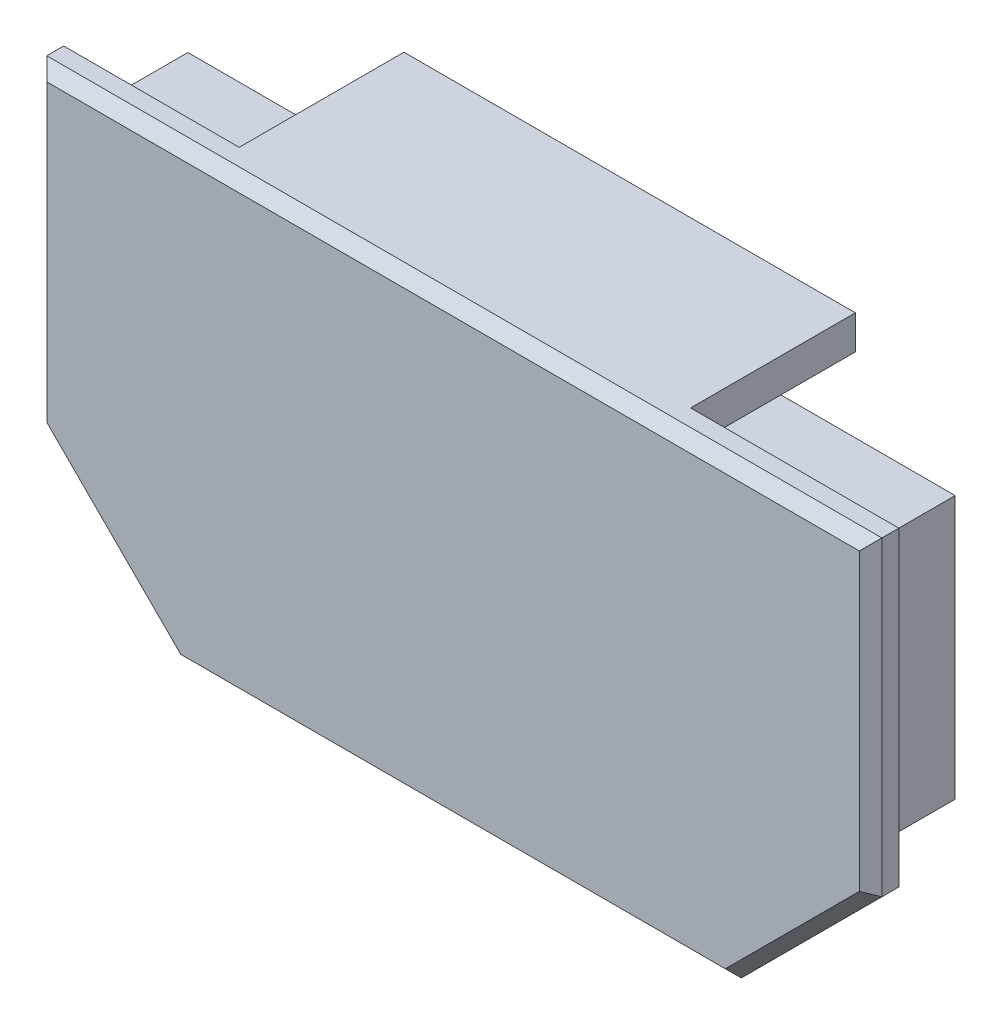
from build123d import *

# Parameters (mm, degrees)
PRESS_FIT_WALL_EXTRUDE_DEPTH = 8
MAIN_LID_EXTRUDE_DEPTH       = 2.5
MAIN_LID_CHAMFER_SIZE        = 1
MAIN_LID_TAB_CUT_DEPTH       = 3
SKETCH5_W                    = 40
SKETCH5_H                    = 3
SERVO_WALL_EXTRUDE_DEPTH     = 14.6


with BuildPart() as part:
    # Sketch2 → Press Fit Wall Extrude (new body)
    with BuildSketch(Plane.XY):
        Polygon((34, -6.3), (34, 17), (-34, 17), (-34, -6.3), (-23.3, -17), (23.3, -17), align=None)
        Polygon((32, -5.471572875), (32, 15), (-32, 15), (-32, -5.471572875), (-22.471572875, -15), (22.471572875, -15), align=None, mode=Mode.SUBTRACT)
    extrude(amount=-PRESS_FIT_WALL_EXTRUDE_DEPTH)

    # Sketch3 → Main Lid Extrude (add)
    with BuildSketch(Plane.XY):
        Polygon((24.542640687, -20), (37, -7.542640687), (37, 20), (-37, 20), (-37, -7.542640687), (-24.542640687, -20), align=None)
    extrude(amount=MAIN_LID_EXTRUDE_DEPTH)

    # Main Lid Chamfer
    main_lid_chamfer_edges = [part.edges().sort_by_distance(p)[0] for p in [
        (0, -20, 2.5),
        (30.771320344, -13.771320344, 2.5),
        (37, 6.228679656, 2.5),
        (0, 20, 2.5),
        (-37, 6.228679656, 2.5),
        (-30.771320344, -13.771320344, 2.5),
    ]]
    chamfer(main_lid_chamfer_edges, length=MAIN_LID_CHAMFER_SIZE)

    # Sketch4 → Main Lid Tab Cut (cut)
    with BuildSketch(Plane.XZ.offset(20)):
        Polygon((-4, 0), (4, 0), (2.267949192, 1), (-2.267949192, 1), align=None)
    extrude(amount=-MAIN_LID_TAB_CUT_DEPTH, mode=Mode.SUBTRACT)

    # Sketch5 → Servo Wall Extrude (add)
    with BuildSketch(Plane(origin=(0, 0, 0), x_dir=(-1, 0, 0), z_dir=(0, 0, -1))):
        with Locations((1.45, 18.5)):
            Rectangle(SKETCH5_W, SKETCH5_H)
    extrude(amount=SERVO_WALL_EXTRUDE_DEPTH)


solid = part.part
